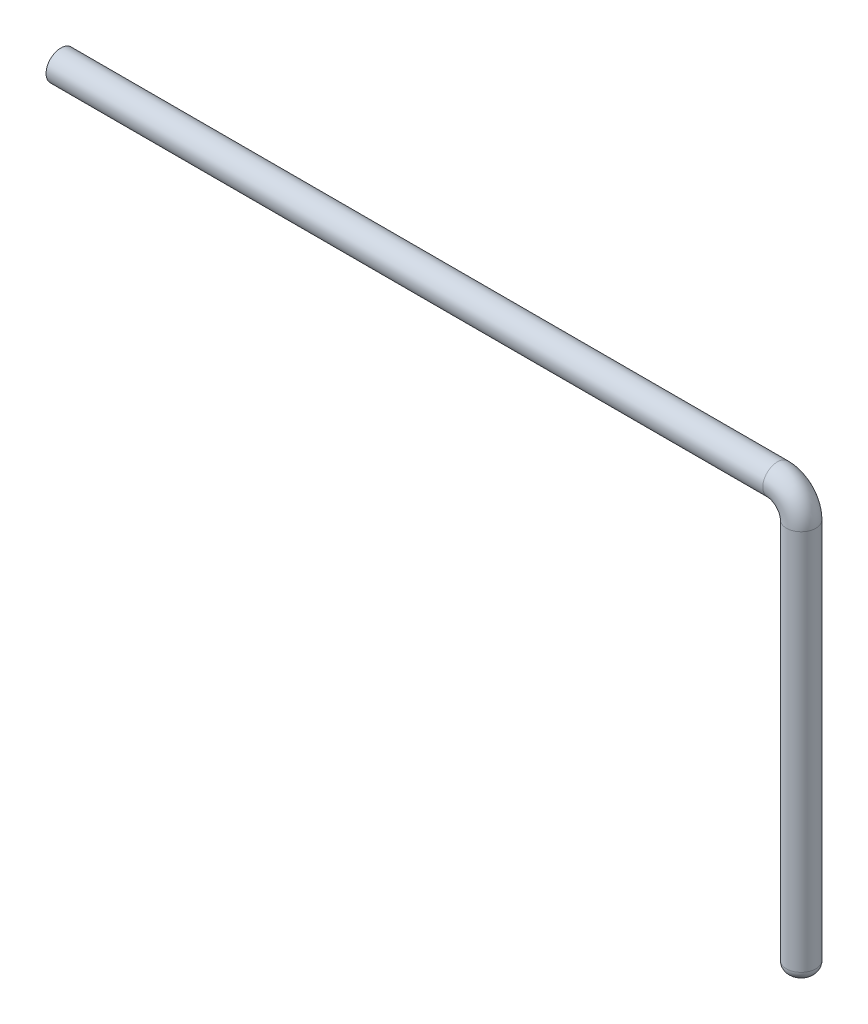
from build123d import *

# Parameters (mm, degrees)
SWEEP_1_PROFILE_R = 0.31
FILLET_1_R        = 0.2


with BuildPart() as part:
    # 扫描1: sweep along a path in 草图1
    with BuildLine(Plane.XY) as sweep_1_path:
        Line((36.707619048, 26.811428571), (51.827619048, 26.811428571))
        ThreePointArc((51.827619048, 26.811428571), (52.181172438, 26.664981962), (52.327619048, 26.311428571))
        Line((52.327619048, 26.311428571), (52.327619048, 18.061428571))
    # 扫描1 profile (on start of the path) → 扫描1 (sweep)
    with BuildSketch(Plane(origin=(36.707619048, 26.811428571, 0), x_dir=(0, 0, 1), z_dir=(1, 0, 0))):
        Circle(SWEEP_1_PROFILE_R)
    sweep(path=sweep_1_path.line)

    # 圆角1
    fillet_1_edges = [part.edges().sort_by_distance(p)[0] for p in [
        (52.327619048, 18.061428571, -0.31),
    ]]
    fillet(fillet_1_edges, radius=FILLET_1_R)


solid = part.part
